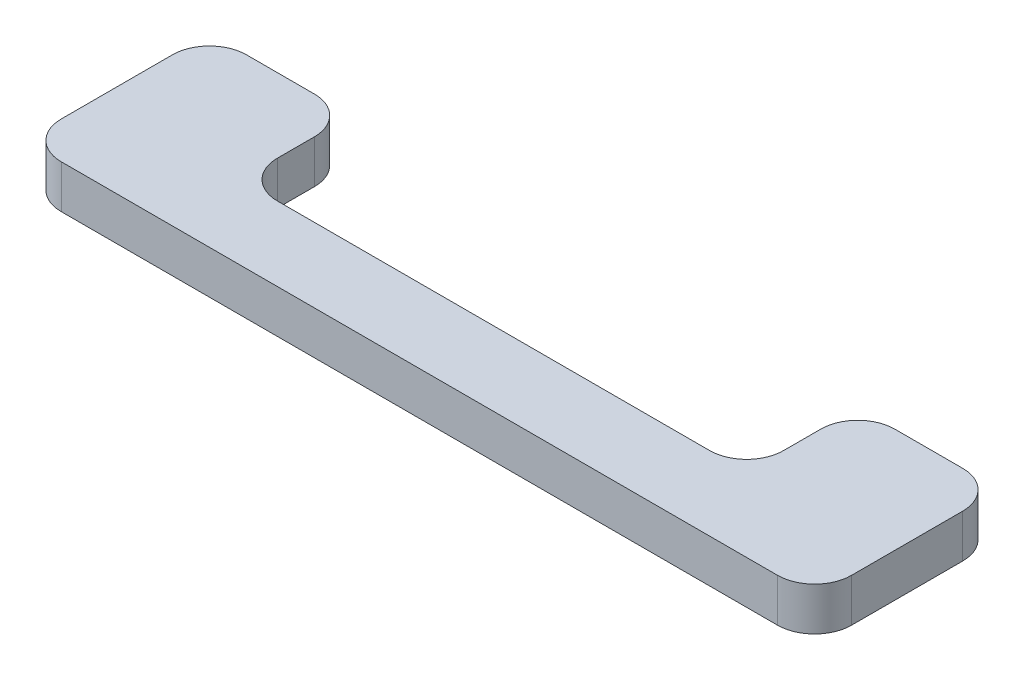
from build123d import *

# Parameters (mm, degrees)
EXTRUDE_1_DEPTH = 35
FILLET_1_R      = 30


with BuildPart() as part:
    # 草图1 → 凸台-拉伸1 (new body)
    with BuildSketch(Plane(origin=(0, 0, 0), x_dir=(1, 0, 0), z_dir=(0, 1, 0))):
        Polygon((205, 0), (-205, 0), (-205, 90), (-320, 90), (-320, -60), (320, -60), (320, 90), (205, 90), align=None)
    extrude(amount=EXTRUDE_1_DEPTH)

    # 圆角1
    fillet_1_edges = [part.edges().sort_by_distance(p)[0] for p in [
        (-205, 17.5, 0),
        (205, 17.5, 0),
        (205, 17.5, -90),
        (320, 17.5, -90),
        (320, 17.5, 60),
        (-320, 17.5, 60),
        (-320, 17.5, -90),
        (-205, 17.5, -90),
    ]]
    fillet(fillet_1_edges, radius=FILLET_1_R)


solid = part.part
